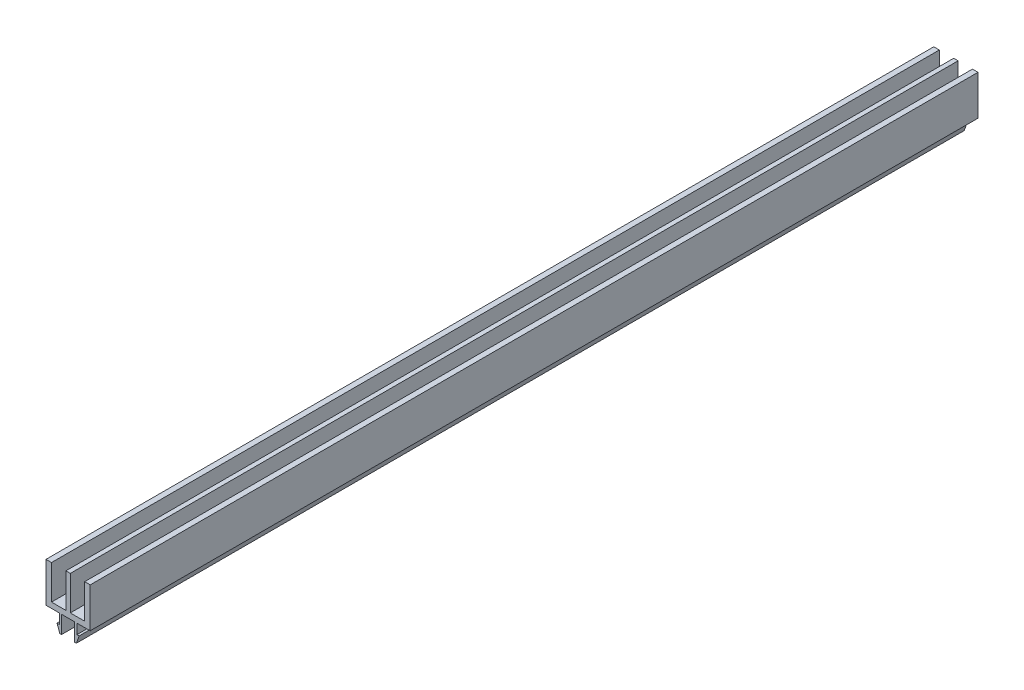
from build123d import *

# Parameters (mm, degrees)
BOSS_EXTRU_1_DEPTH = 401.71


with BuildPart() as part:
    # Esquisse1 → Boss.-Extru.1 (new body)
    with BuildSketch(Plane.XY.offset(50)):
        Polygon((-1, 2.5), (-7.5, 2.5), (-7.5, 17.999999998), (-10, 17.999999998), (-10, 0), (-4, 0), (-4, -4.5), (-5, -4.5), (-3.75, -8), (-3, -8), (-3, 0), (3, 0), (3, -8), (3.75, -8), (5, -4.5), (4, -4.5), (4, 0), (10, 0), (10, 17.999999998), (7.5, 17.999999998), (7.5, 2.5), (1, 2.5), (1, 17.999999998), (-1, 17.999999998), align=None)
    extrude(amount=-BOSS_EXTRU_1_DEPTH)


solid = part.part
